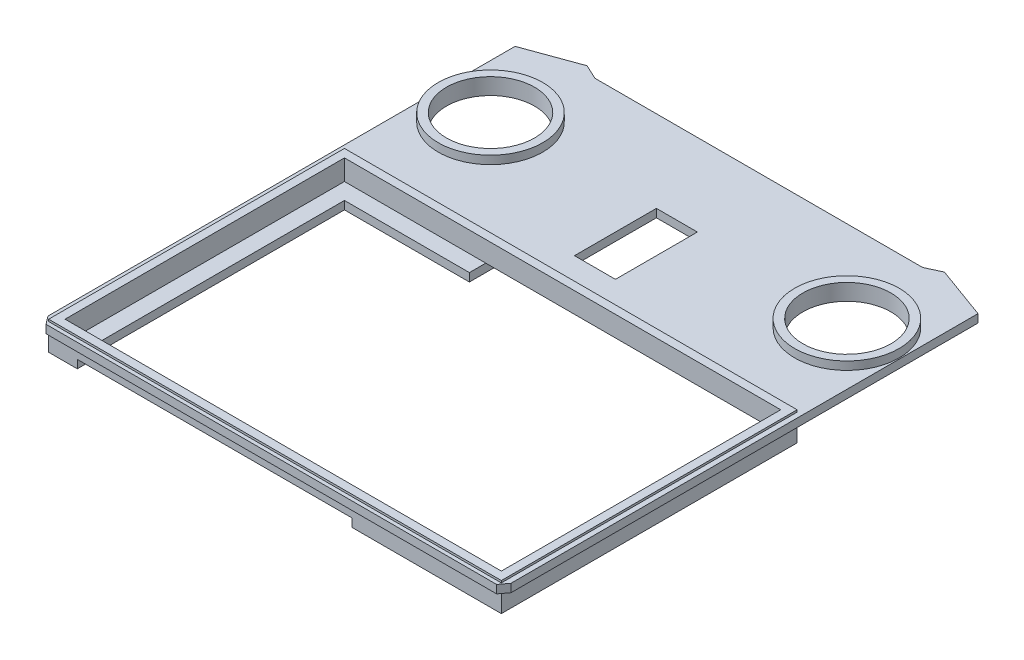
from build123d import *

# Parameters (mm, degrees)
SKETCH1_W             = 110.5
SKETCH1_H             = 72.2
SKETCH1_W_2           = 106.5
SKETCH1_H_2           = 68.2
BOSS_EXTRUDE1_DEPTH   = 5
BOSS_EXTRUDE2_DEPTH   = 2
SKETCH4_R             = 12.75
SKETCH4_R_2           = 10.75
BOSS_EXTRUDE3_DEPTH   = 2
BOSS_EXTRUDE3_2_DEPTH = 2
SKETCH5_R             = 10.75
SKETCH5_W             = 106.5
SKETCH5_H             = 68.2
SKETCH5_W_2           = 10
SKETCH5_H_2           = 20
BOSS_EXTRUDE4_DEPTH   = 2


with BuildPart() as part:
    # Sketch1 → Boss-Extrude1 (new body)
    with BuildSketch(Plane(origin=(0, 8.5, 0), x_dir=(1, 0, 0), z_dir=(0, 1, 0))):
        Rectangle(SKETCH1_W, SKETCH1_H)
        Rectangle(SKETCH1_W_2, SKETCH1_H_2, mode=Mode.SUBTRACT)
    extrude(amount=BOSS_EXTRUDE1_DEPTH)

    # Sketch2 → Boss-Extrude2 (add)
    with BuildSketch(Plane(origin=(0, 8.5, 0), x_dir=(1, 0, 0), z_dir=(0, 1, 0))):
        Polygon((-55.25, 36.1), (-55.25, -36.1), (-48.25, -36.1), (-48.25, -30.1), (-49.25, -30.1), (-49.25, 30.1), (-18.75, 30.1), (-18.75, 36.1), align=None)
        Polygon((55.25, -36.1), (55.25, 36.1), (48.25, 36.1), (48.25, 30.1), (49.25, 30.1), (49.25, -30.1), (18.75, -30.1), (18.75, -36.1), align=None)
    extrude(amount=-BOSS_EXTRUDE2_DEPTH)



with BuildPart() as body_2:
    # Sketch4 → Boss-Extrude3 (new body)
    with BuildSketch(Plane(origin=(0, 13, 0), x_dir=(1, 0, 0), z_dir=(0, 1, 0))):
        with Locations((-43.5, 60)):
            Circle(SKETCH4_R)
        with Locations((-43.5, 60)):
            Circle(SKETCH4_R_2, mode=Mode.SUBTRACT)
    extrude(amount=BOSS_EXTRUDE3_DEPTH)


with BuildPart() as body_3:
    # Sketch4 → Boss-Extrude3 2 (new body)
    with BuildSketch(Plane(origin=(0, 13, 0), x_dir=(1, 0, 0), z_dir=(0, 1, 0))):
        with Locations((43.5, 60)):
            Circle(SKETCH4_R)
        with Locations((43.5, 60)):
            Circle(SKETCH4_R_2, mode=Mode.SUBTRACT)
    extrude(amount=BOSS_EXTRUDE3_2_DEPTH)


with BuildPart() as part_1:
    add(part.part)

    add(body_2.part)  # Boss-Extrude4 merges body 2

    add(body_3.part)  # Boss-Extrude4 merges body 3
    # Sketch5 → Boss-Extrude4 (add)
    with BuildSketch(Plane(origin=(0, 13, 0), x_dir=(1, 0, 0), z_dir=(0, 1, 0))):
        Polygon((-56.5, -35), (-56.5, 79), (-43.619883045, 83.687979185), (-40, 82), (40, 82), (43.619883045, 83.687979185), (56.5, 79), (56.5, -35), (55, -37), (-55, -37), align=None)
        with Locations((-43.5, 60)):
            Circle(SKETCH5_R, mode=Mode.SUBTRACT)
        with Locations((43.5, 60)):
            Circle(SKETCH5_R, mode=Mode.SUBTRACT)
        Rectangle(SKETCH5_W, SKETCH5_H, mode=Mode.SUBTRACT)
        with Locations((0, 52)):
            Rectangle(SKETCH5_W_2, SKETCH5_H_2, mode=Mode.SUBTRACT)
    extrude(amount=-BOSS_EXTRUDE4_DEPTH)


solid = part_1.part
